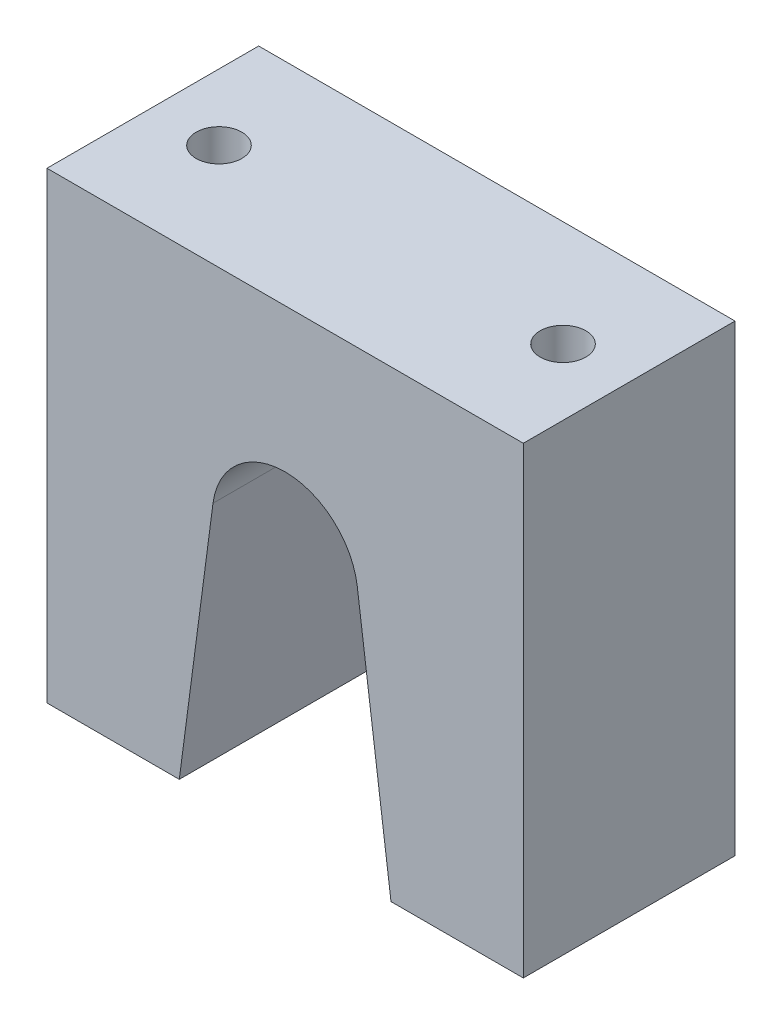
from build123d import *

# Parameters (mm, degrees)
BOSS_EXTRUDE1_DEPTH       = 16
F_8_36_TAPPED_HOLE1_D     = 3.4544
F_8_36_TAPPED_HOLE1_DEPTH = 25
F_8_36_TAPPED_HOLE1_TIP   = 1.037806461


with BuildPart() as part:
    # Sketch1 → Boss-Extrude1 (new body)
    with BuildSketch(Plane.XY):
        with BuildLine():
            Line((5.452946738, 0.717894057), (8, -18.628896236))
            Line((8, -18.628896236), (18, -18.628896236))
            Line((18, -18.628896236), (18, 16.371103764))
            Line((18, 16.371103764), (-18, 16.371103764))
            Line((-18, 16.371103764), (-18, -18.628896236))
            Line((-18, -18.628896236), (-8, -18.628896236))
            Line((-8, -18.628896236), (-5.452946738, 0.717894057))
            ThreePointArc((-5.452946738, 0.717894057), (0, 5.5), (5.452946738, 0.717894057))
        make_face()
    extrude(amount=BOSS_EXTRUDE1_DEPTH)

    # #8-36 Tapped Hole1
    with Locations(Plane(origin=(0, 16.371103764, 0), x_dir=(1, 0, 0), z_dir=(0, 1, 0))):
        with Locations((-13, -8), (13, -8)):
            Hole(F_8_36_TAPPED_HOLE1_D / 2, depth=F_8_36_TAPPED_HOLE1_DEPTH)
            with Locations((0, 0, -(F_8_36_TAPPED_HOLE1_DEPTH + F_8_36_TAPPED_HOLE1_TIP / 2))):  # 118° drill point
                Cone(0, F_8_36_TAPPED_HOLE1_D / 2, F_8_36_TAPPED_HOLE1_TIP, mode=Mode.SUBTRACT)


solid = part.part
